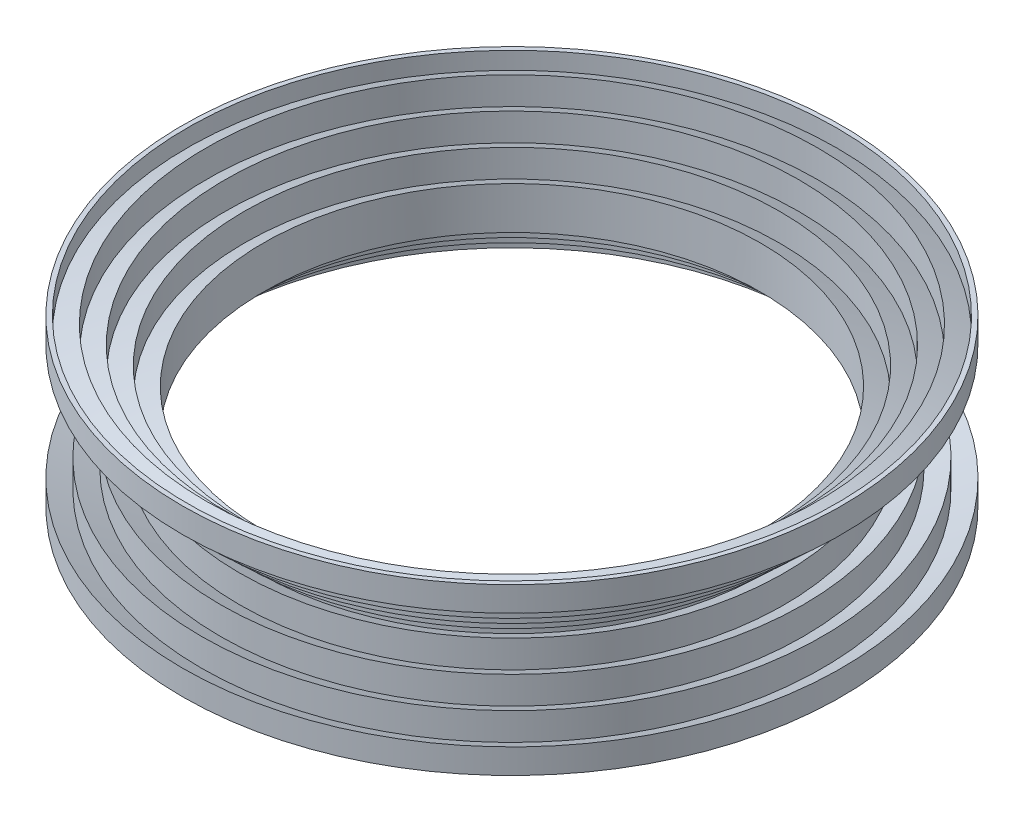
from build123d import *

# Parameters (mm, degrees)
SKETCH_1_R      = 35.893803705
EXTRUDE_1_DEPTH = 1.2
SHELL_1_T       = -0.5


with BuildPart() as part:
    # 스케치1 → 보스-돌출1 (new body)
    with BuildSketch(Plane(origin=(0, 0, 0), x_dir=(1, 0, 0), z_dir=(0, 1, 0))):
        with Locations(Location((0, 0, 0), (0, 0, 270))):
            Circle(SKETCH_1_R)
    extrude_1 = extrude(amount=EXTRUDE_1_DEPTH)

    # 스케치4 → 회전1 (revolve)
    with BuildSketch(Plane(origin=(0, 0, 0), x_dir=(0, 0, -1), z_dir=(1, 0, 0))):
        Polygon((-35.893803705, 2.7), (-35.893803705, 1.2), (0, 1.2), (0, 9), (-27.584076439, 9), (-27.584076439, 7.504385483), (-29.661508256, 8.553289112), (-29.661508256, 7.053289112), (-29.661508256, 5.553289112), (-31.738940072, 6.602192742), (-31.738940072, 5.102192742), (-31.738940072, 3.602192742), (-33.816371888, 4.651096371), (-33.816371888, 3.151096371), (-33.816371888, 1.651096371), align=None)
    revolve_1 = revolve(axis=Axis((0, 9, 0), (0, -1, 0)))

    # 대칭 복사1: 보스-돌출1, 회전1 across plane
    add(extrude_1.mirror(Plane(origin=(0, 9, 0), x_dir=(0, 0, 1), z_dir=(0, -1, 0))))
    add(revolve_1.mirror(Plane(origin=(0, 9, 0), x_dir=(0, 0, 1), z_dir=(0, -1, 0))))

    # 쉘1
    shell_1_openings = [part.faces().sort_by_distance(p)[0] for p in [
        (0, 18, 0),
        (0, 0, 0),
    ]]
    offset(amount=SHELL_1_T, openings=shell_1_openings, kind=Kind.INTERSECTION)


solid = part.part
